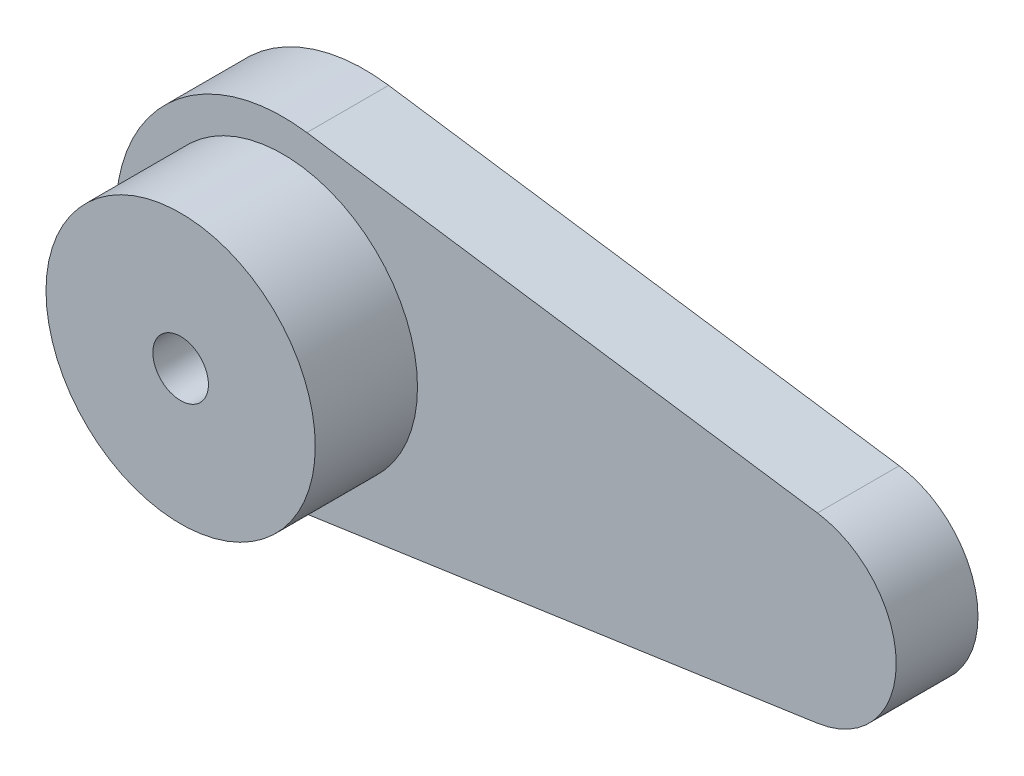
from build123d import *

# Parameters (mm, degrees)
BOSS_EXTRUDE3_DEPTH = 5
SKETCH3_R           = 6.585
BOSS_EXTRUDE4_DEPTH = 5
SKETCH5_R           = 4.185
CUT_EXTRUDE1_DEPTH  = 7.5
SKETCH4_W           = 2.04
SKETCH4_H           = 1.02
SKETCH4_W_2         = 1.02
SKETCH4_H_2         = 2.04
BOSS_EXTRUDE5_DEPTH = 7.5
SKETCH6_R           = 1.36
CUT_EXTRUDE2_DEPTH  = 2.5
SKETCH7_R           = 6.585
CUT_EXTRUDE3_DEPTH  = 1
FILLET1_R           = 0.5


with BuildPart() as part:
    # Sketch1 → Boss-Extrude3 (new body)
    with BuildSketch(Plane.XY):
        with BuildLine():
            Line((1.173518627, 8.08022766), (26.146764706, 4.453279176))
            ThreePointArc((26.146764706, 4.453279176), (30, 0), (26.146764706, -4.453279176))
            Line((26.146764706, -4.453279176), (1.173518627, -8.08022766))
            ThreePointArc((1.173518627, -8.08022766), (-8.165, 0), (1.173518627, 8.08022766))
        make_face()
    extrude(amount=BOSS_EXTRUDE3_DEPTH)

    # Sketch3 → Boss-Extrude4 (add)
    with BuildSketch(Plane.XY.offset(5)):
        Circle(SKETCH3_R)
    extrude(amount=BOSS_EXTRUDE4_DEPTH)

    # Sketch5 → Cut-Extrude1 (cut)
    with BuildSketch(Plane(origin=(0, 0, 0), x_dir=(-1, 0, 0), z_dir=(0, 0, -1))):
        Circle(SKETCH5_R)
    extrude(amount=-CUT_EXTRUDE1_DEPTH, mode=Mode.SUBTRACT)

    # Sketch4 → Boss-Extrude5 (add)
    with BuildSketch(Plane(origin=(0, 0, 0), x_dir=(-1, 0, 0), z_dir=(0, 0, -1))):
        with Locations((0, 3.675)):
            Rectangle(SKETCH4_W, SKETCH4_H)
        with Locations((3.675, 0)):
            Rectangle(SKETCH4_W_2, SKETCH4_H_2)
        with Locations((0, -3.675)):
            Rectangle(SKETCH4_W, SKETCH4_H)
        with Locations((-3.675, 0)):
            Rectangle(SKETCH4_W_2, SKETCH4_H_2)
    extrude(amount=-BOSS_EXTRUDE5_DEPTH)

    # Sketch6 → Cut-Extrude2 (cut)
    with BuildSketch(Plane.XY.offset(10)):
        Circle(SKETCH6_R)
    extrude(amount=-CUT_EXTRUDE2_DEPTH, mode=Mode.SUBTRACT)

    # Sketch7 → Cut-Extrude3 (cut)
    with BuildSketch(Plane(origin=(0, 0, 0), x_dir=(-1, 0, 0), z_dir=(0, 0, -1))):
        with BuildLine():
            Line((-26.146764706, 4.453279176), (-1.173518627, 8.08022766))
            ThreePointArc((-1.173518627, 8.08022766), (8.165, 0), (-1.173518627, -8.08022766))
            Line((-1.173518627, -8.08022766), (-26.146764706, -4.453279176))
            ThreePointArc((-26.146764706, -4.453279176), (-30, 0), (-26.146764706, 4.453279176))
        make_face()
        with Locations(Location((0, 0, 0), (0, 0, 180))):
            Circle(SKETCH7_R, mode=Mode.SUBTRACT)
    extrude(amount=-CUT_EXTRUDE3_DEPTH, mode=Mode.SUBTRACT)

    # Fillet1
    fillet1_edges = [part.edges().sort_by_distance(p)[0] for p in [
        (-6.585, 0, 0),
    ]]
    fillet(fillet1_edges, radius=FILLET1_R)


solid = part.part
